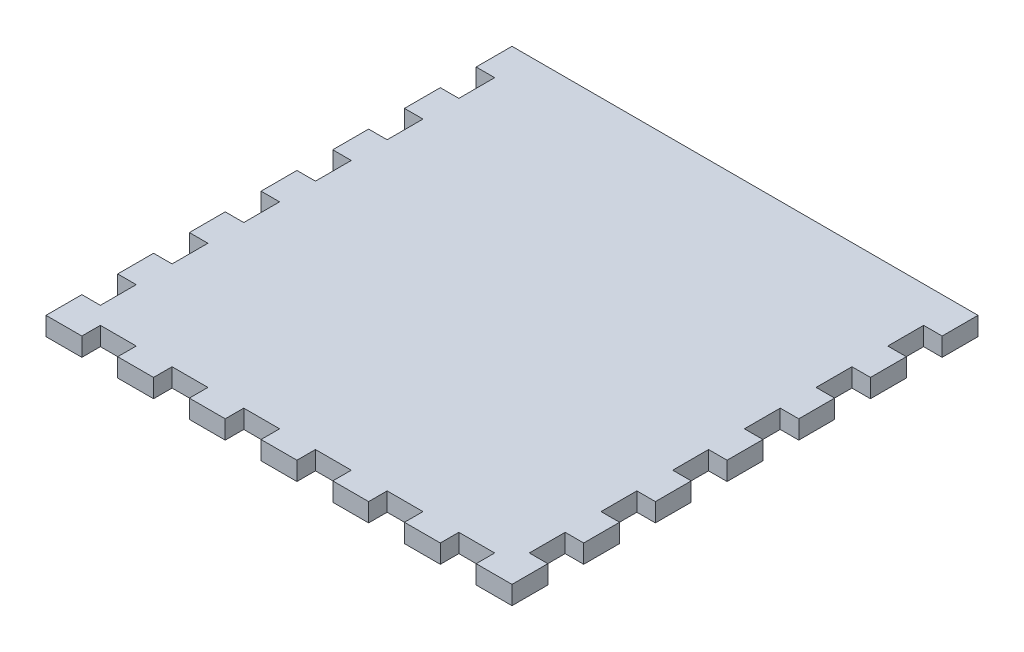
from build123d import *

# Parameters (mm, degrees)
SKETCH1_W           = 80
SKETCH1_H           = 80
BOSS_EXTRUDE1_DEPTH = 1.5875
SKETCH2_OUTSIDE_W   = 104.636
SKETCH2_OUTSIDE_H   = 104.636
CUT_EXTRUDE1_DEPTH  = 57.657573413
SKETCH3_W           = 80
SKETCH3_H           = 6.153846154
BOSS_EXTRUDE2_DEPTH = 3.175


with BuildPart() as part:
    # Sketch1 → Boss-Extrude1 (new, symmetric)
    with BuildSketch(Plane(origin=(0, 0, 0), x_dir=(1, 0, 0), z_dir=(0, 1, 0))):
        Rectangle(SKETCH1_W, SKETCH1_H)
    extrude(amount=BOSS_EXTRUDE1_DEPTH, both=True)

    # Sketch2 outside → Cut-Extrude1 (cut, through all)
    with BuildSketch(Plane(origin=(0, 1.5875, 0), x_dir=(1, 0, 0), z_dir=(0, 1, 0))):
        Rectangle(SKETCH2_OUTSIDE_W, SKETCH2_OUTSIDE_H)
        Polygon((-40, 40), (-40, 33.846153846), (-36.82, 33.846153846), (-36.82, 27.692307692), (-40, 27.692307692), (-40, 21.538461538), (-36.82, 21.538461538), (-36.82, 15.384615385), (-40, 15.384615385), (-40, 9.230769231), (-36.82, 9.230769231), (-36.82, 3.076923077), (-40, 3.076923077), (-40, -3.076923077), (-36.82, -3.076923077), (-36.82, -9.230769231), (-40, -9.230769231), (-40, -15.384615385), (-36.82, -15.384615385), (-36.82, -21.538461538), (-40, -21.538461538), (-40, -27.692307692), (-36.82, -27.692307692), (-36.82, -33.846153846), (-40, -33.846153846), (-40, -40), (-33.846153846, -40), (-33.846153846, -36.82), (-27.692307692, -36.82), (-27.692307692, -40), (-21.538461538, -40), (-21.538461538, -36.82), (-15.384615385, -36.82), (-15.384615385, -40), (-9.230769231, -40), (-9.230769231, -36.82), (-3.076923077, -36.82), (-3.076923077, -40), (3.076923077, -40), (3.076923077, -36.82), (9.230769231, -36.82), (9.230769231, -40), (15.384615385, -40), (15.384615385, -36.82), (21.538461538, -36.82), (21.538461538, -40), (27.692307692, -40), (27.692307692, -36.82), (33.846153846, -36.82), (33.846153846, -40), (40, -40), (40, -33.846153846), (36.82, -33.846153846), (36.82, -27.692307692), (40, -27.692307692), (40, -21.538461538), (36.82, -21.538461538), (36.82, -15.384615385), (40, -15.384615385), (40, -9.230769231), (36.82, -9.230769231), (36.82, -3.076923077), (40, -3.076923077), (40, 3.076923077), (36.82, 3.076923077), (36.82, 9.230769231), (40, 9.230769231), (40, 15.384615385), (36.82, 15.384615385), (36.82, 21.538461538), (40, 21.538461538), (40, 27.692307692), (36.82, 27.692307692), (36.82, 33.846153846), (40, 33.846153846), (40, 40), (33.846153846, 40), (33.846153846, 36.82), (27.692307692, 36.82), (27.692307692, 40), (21.538461538, 40), (21.538461538, 36.82), (15.384615385, 36.82), (15.384615385, 40), (9.230769231, 40), (9.230769231, 36.82), (3.076923077, 36.82), (3.076923077, 40), (-3.076923077, 40), (-3.076923077, 36.82), (-9.230769231, 36.82), (-9.230769231, 40), (-15.384615385, 40), (-15.384615385, 36.82), (-21.538461538, 36.82), (-21.538461538, 40), (-27.692307692, 40), (-27.692307692, 36.82), (-33.846153846, 36.82), (-33.846153846, 40), align=None, mode=Mode.SUBTRACT)
    extrude(amount=-CUT_EXTRUDE1_DEPTH, mode=Mode.SUBTRACT)

    # Sketch3 → Boss-Extrude2 (add)
    with BuildSketch(Plane(origin=(0, 1.5875, 0), x_dir=(1, 0, 0), z_dir=(0, 1, 0))):
        with Locations((0, 36.923076923)):
            Rectangle(SKETCH3_W, SKETCH3_H)
    extrude(amount=-BOSS_EXTRUDE2_DEPTH)


solid = part.part
